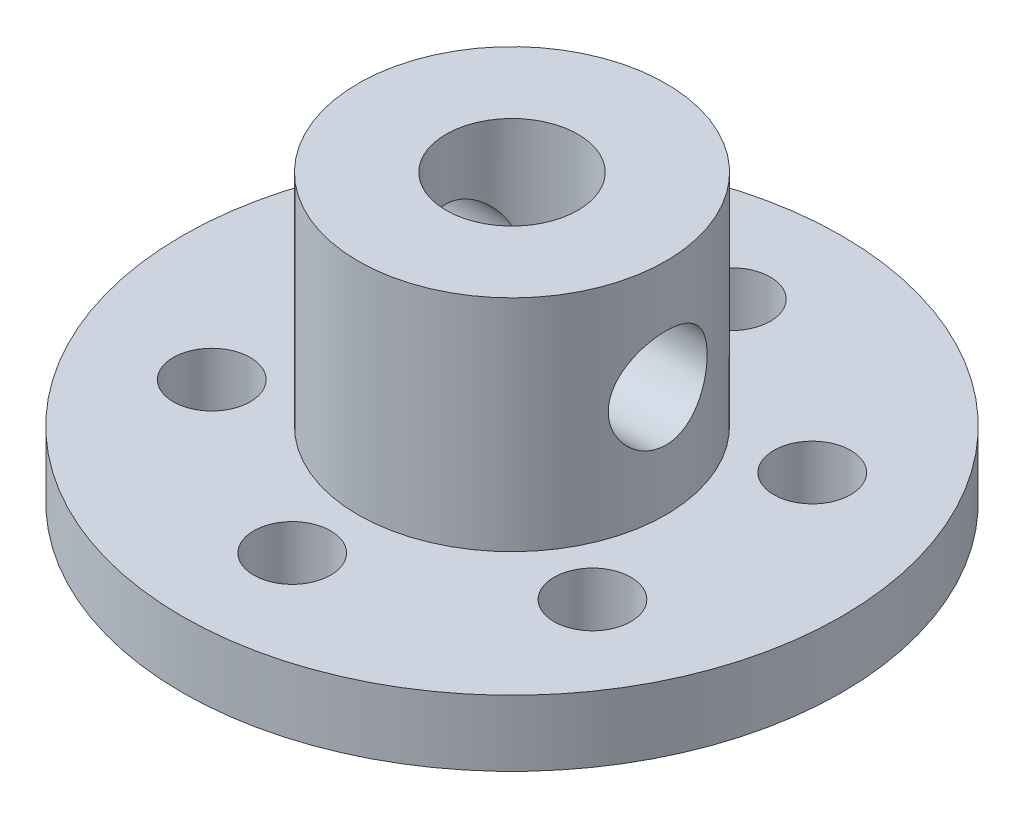
from build123d import *

# Parameters (mm, degrees)
SKETCH1_R               = 15
SKETCH1_R_2             = 1.75
SKETCH1_R_3             = 7
BOSS_EXTRUDE1_DEPTH     = 3
SKETCH1_3_R             = 7
SKETCH1_3_R_2           = 3
BOSS_EXTRUDE2_DEPTH     = 13
CUT_EXTRUDE1_DEPTH      = 25.879710609
CUT_EXTRUDE1_DEPTH_BACK = 25.879710609
SKETCH2_R               = 2.25


with BuildPart() as part:
    # Sketch1 → Boss-Extrude1 (new body)
    with BuildSketch(Plane(origin=(0, 0, 0), x_dir=(1, 0, 0), z_dir=(0, 1, 0))):
        Circle(SKETCH1_R)
        with Locations((-8.660254038, -5)):
            Circle(SKETCH1_R_2, mode=Mode.SUBTRACT)
        with Locations((0, -10)):
            Circle(SKETCH1_R_2, mode=Mode.SUBTRACT)
        with Locations((8.660254038, -5)):
            Circle(SKETCH1_R_2, mode=Mode.SUBTRACT)
        with Locations((-8.660254038, 5)):
            Circle(SKETCH1_R_2, mode=Mode.SUBTRACT)
        Circle(SKETCH1_R_3, mode=Mode.SUBTRACT)
        with Locations((8.660254038, 5)):
            Circle(SKETCH1_R_2, mode=Mode.SUBTRACT)
        with Locations((0, 10)):
            Circle(SKETCH1_R_2, mode=Mode.SUBTRACT)
    extrude(amount=BOSS_EXTRUDE1_DEPTH)

    # Sketch1<3> → Boss-Extrude2 (add)
    with BuildSketch(Plane(origin=(0, 0, 0), x_dir=(1, 0, 0), z_dir=(0, 1, 0))):
        Circle(SKETCH1_3_R)
        Circle(SKETCH1_3_R_2, mode=Mode.SUBTRACT)
    extrude(amount=BOSS_EXTRUDE2_DEPTH)

    # Sketch2 → Cut-Extrude1 (cut, two sides: drawn at the far end of the back side and taken through both)
    with BuildSketch(Plane(origin=(0, 0, 0), x_dir=(0, 0, -1), z_dir=(1, 0, 0)).offset(-CUT_EXTRUDE1_DEPTH_BACK)):
        with Locations((0, 8)):
            Circle(SKETCH2_R)
    extrude(amount=CUT_EXTRUDE1_DEPTH + CUT_EXTRUDE1_DEPTH_BACK, mode=Mode.SUBTRACT)


solid = part.part
